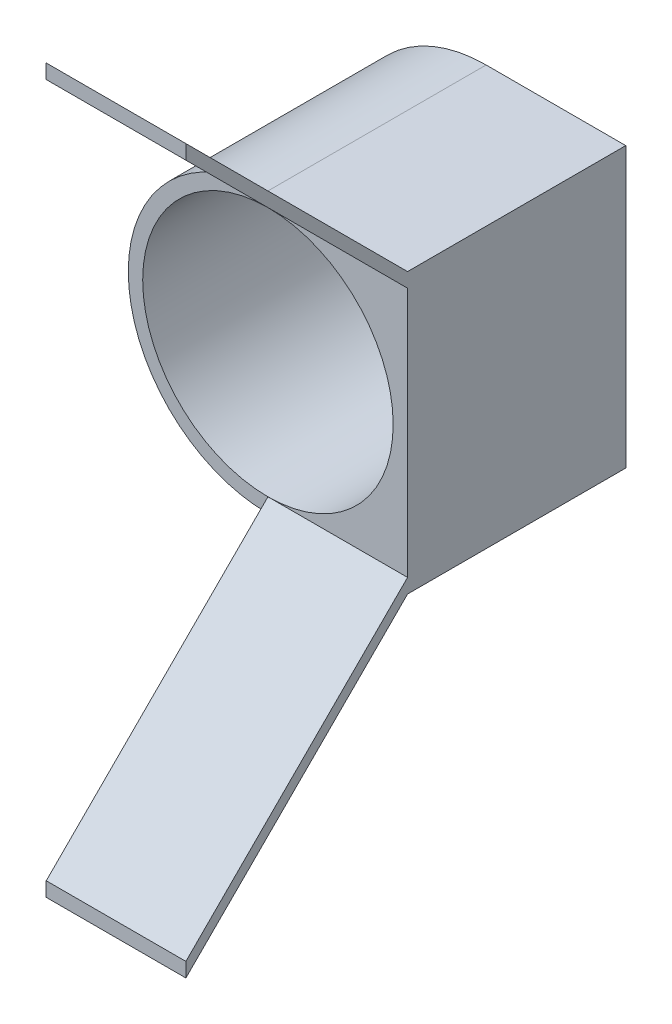
from build123d import *

# Parameters (mm, degrees)
SKETCH1_R           = 16
SKETCH1_R_2         = 14.35
BOSS_EXTRUDE1_DEPTH = 25
BOSS_EXTRUDE3_DEPTH = 25
BOSS_EXTRUDE4_DEPTH = 16


with BuildPart() as part:
    # Sketch1 → Boss-Extrude1 (new body)
    with BuildSketch(Plane.XY):
        Circle(SKETCH1_R)
        Circle(SKETCH1_R_2, mode=Mode.SUBTRACT)
    extrude(amount=BOSS_EXTRUDE1_DEPTH)

    # Sketch3 → Boss-Extrude3 (add)
    with BuildSketch(Plane.XY):
        with BuildLine():
            Line((16, 16), (0, 16))
            ThreePointArc((0, 16), (11.313708499, 11.313708499), (16, 0))
            Line((16, 0), (16, 16))
        make_face()
        with BuildLine():
            Line((16, -16), (16, 0))
            ThreePointArc((16, 0), (11.313708499, -11.313708499), (0, -16))
            Line((0, -16), (16, -16))
        make_face()
    extrude(amount=BOSS_EXTRUDE3_DEPTH)

    # Sketch2 → Boss-Extrude4 (add)
    with BuildSketch(Plane(origin=(0, 0, 0), x_dir=(0, 0, -1), z_dir=(1, 0, 0))):
        Polygon((-25, 14.35), (-50.4, 39.75), (-50.4, 41.4), (-25, 16), align=None)
        Polygon((-25, -14.35), (-25, -16), (-50.4, -41.4), (-50.4, -39.75), align=None)
    extrude(amount=BOSS_EXTRUDE4_DEPTH)


solid = part.part
